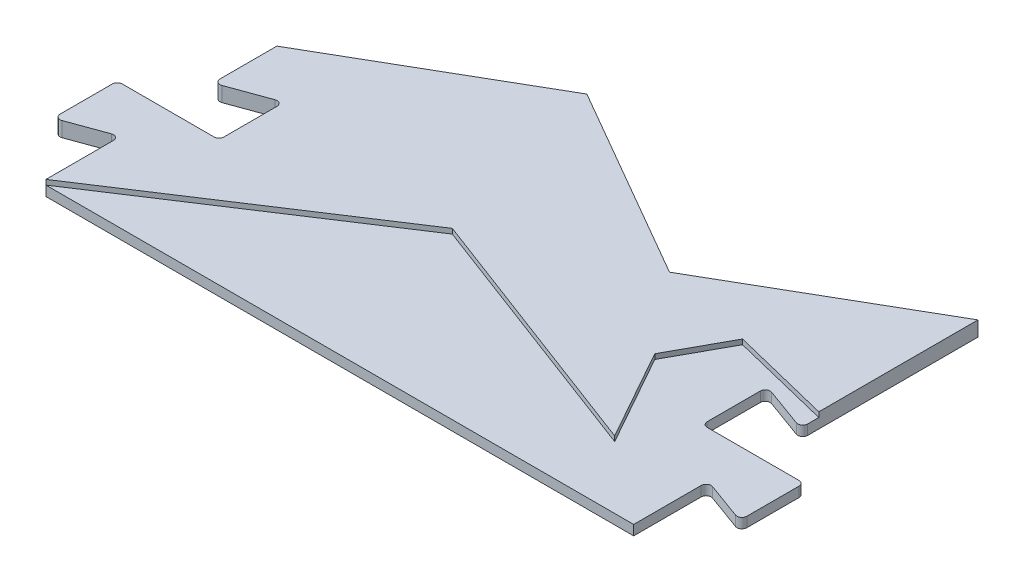
from build123d import *

# Parameters (mm, degrees)
P_IDAT_VYSUNUT_M1_DEPTH = 3
P_IDAT_VYSUNUT_M2_DEPTH = 2
ZAOBLIT4_R              = 1


with BuildPart() as part:
    # Skica1 → Přidat vysunutím1 (new body)
    with BuildSketch(Plane(origin=(0, 0, 0), x_dir=(1, 0, 0), z_dir=(0, 1, 0))):
        Polygon((-118.143750166, 15), (-118.143750166, 0), (-68.779346971, 32.313398106), (-16.32734533, 12.51119421), (-26.593132493, 30.830954414), (-20.343228113, 42.230019956), (0, 37.22), (0, 69.22), (-39.317553332, 46.52), (-78.635106664, 69.22), (-118.143185584, 46.41), (-118.143185584, 33.5570142), (-107.643750166, 37.378496169), (-107.643750166, 24.278496169), (-128.093750166, 24.278496169), (-128.093750166, 11.378496169), align=None)
    extrude(amount=P_IDAT_VYSUNUT_M1_DEPTH)

    # Skica1<5> → Přidat vysunutím2 (add)
    with BuildSketch(Plane(origin=(0, 0, 0), x_dir=(1, 0, 0), z_dir=(0, 1, 0))):
        Polygon((-68.779346971, 32.313398106), (-118.143750166, 0), (0, 0), (0, 15), (9.950504516, 11.37831254), (9.950504516, 24.27831254), (-10.5, 24.27831254), (-10.5, 37.37831254), (0, 33.55662508), (0, 37.22), (-20.343228113, 42.230019956), (-26.593132493, 30.830954414), (-16.32734533, 12.51119421), align=None)
    extrude(amount=P_IDAT_VYSUNUT_M2_DEPTH)

    # Zaoblit4
    zaoblit4_edges = [part.edges().sort_by_distance(p)[0] for p in [
        (0, 1, -33.55662508),
        (-10.5, 1, -24.27831254),
        (-10.5, 1, -37.37831254),
        (0, 1, -15),
        (9.950504516, 1, -11.37831254),
        (9.950504516, 1, -24.27831254),
        (-128.093750166, 1.5, -11.378496169),
        (-128.093750166, 1.5, -24.278496169),
        (-107.643750166, 1.5, -24.278496169),
        (-107.643750166, 1.5, -37.378496169),
        (-118.143185584, 1.5, -33.5570142),
        (-118.143750166, 1.5, -15),
    ]]
    fillet(zaoblit4_edges, radius=ZAOBLIT4_R)


solid = part.part
